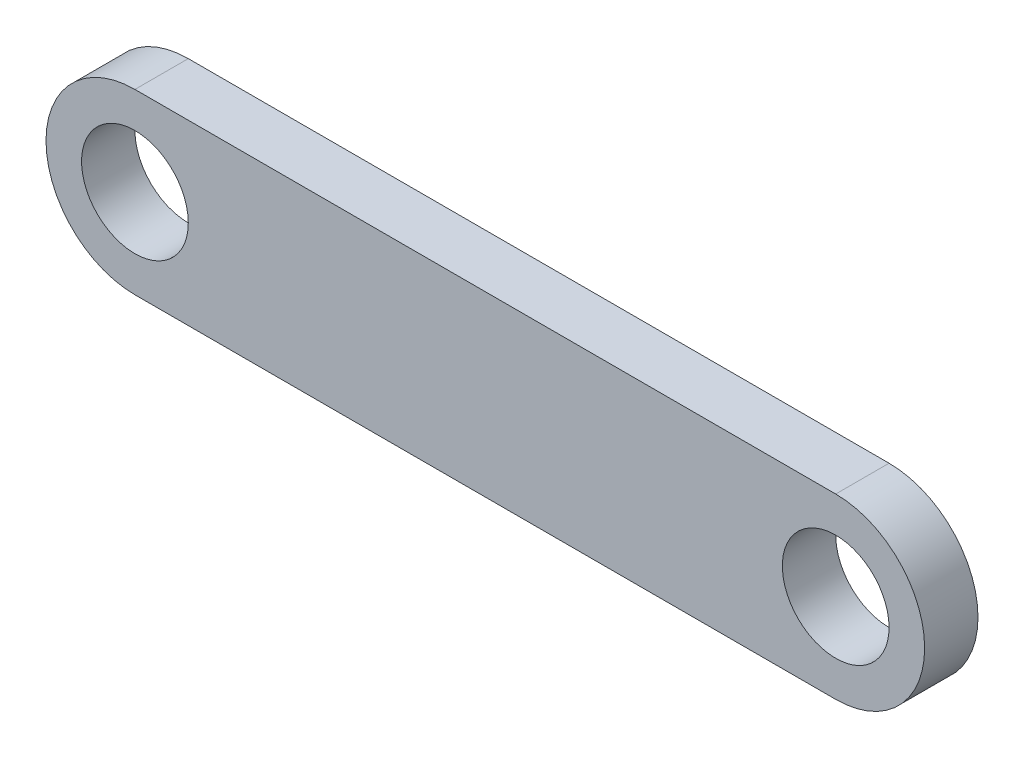
from build123d import *

# Parameters (mm, degrees)
SKETCH_1_R      = 3
EXTRUDE_1_DEPTH = 3


with BuildPart() as part:
    # ｽｹｯﾁ1 → ﾎﾞｽ - 押し出し1 (new body)
    with BuildSketch(Plane.XY):
        with BuildLine():
            Line((-19.7, 5), (19.7, 5))
            ThreePointArc((19.7, 5), (24.7, 0), (19.7, -5))
            Line((19.7, -5), (-19.7, -5))
            ThreePointArc((-19.7, -5), (-24.7, 0), (-19.7, 5))
        make_face()
        with Locations((-19.7, 0)):
            Circle(SKETCH_1_R, mode=Mode.SUBTRACT)
        with Locations((19.7, 0)):
            Circle(SKETCH_1_R, mode=Mode.SUBTRACT)
    extrude(amount=EXTRUDE_1_DEPTH)


solid = part.part
